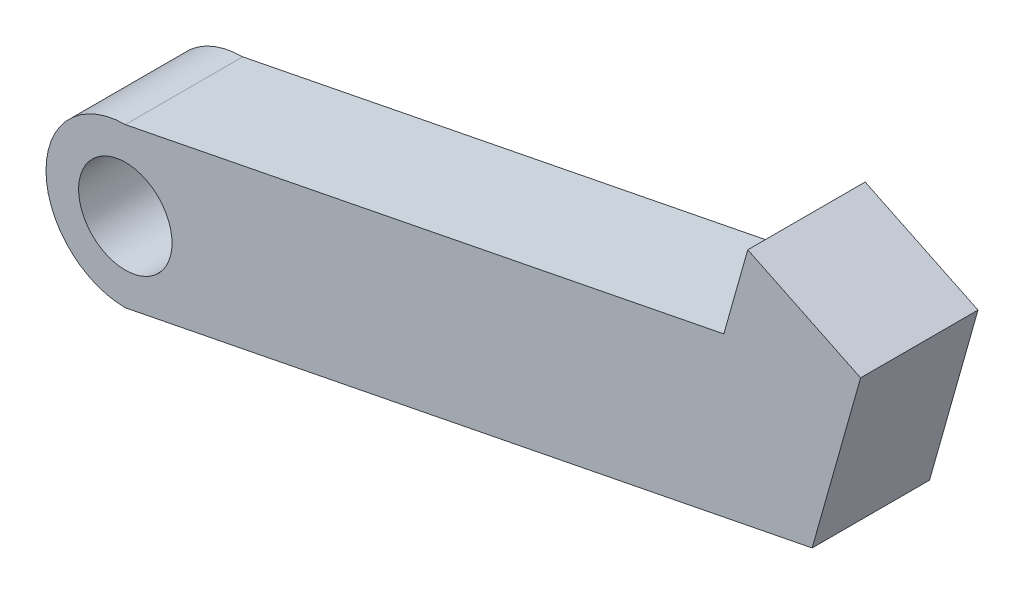
from build123d import *

# Parameters (mm, degrees)
SKETCH1_R           = 3.3655
BOSS_EXTRUDE1_DEPTH = 8.4582


with BuildPart() as part:
    # Sketch1 → Boss-Extrude1 (new body)
    with BuildSketch(Plane.XY):
        with BuildLine():
            Line((0, -5.715), (49.478755061, 4.038876919))
            Line((49.478755061, 4.038876919), (52.970636438, 16.400040583))
            Line((52.970636438, 16.400040583), (44.841572695, 20.325295455))
            Line((44.841572695, 20.325295455), (43.115328279, 14.214437887))
            Line((43.115328279, 14.214437887), (0, 5.715))
            ThreePointArc((0, 5.715), (-5.715, 0), (0, -5.715))
        make_face()
        Circle(SKETCH1_R, mode=Mode.SUBTRACT)
    extrude(amount=BOSS_EXTRUDE1_DEPTH)


solid = part.part
